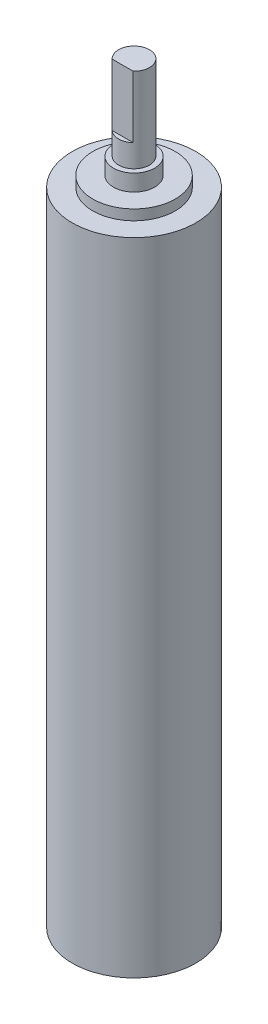
from build123d import *

# Parameters (mm, degrees)
SKETCH1_R             = 3
MOTORANDGEARBOX_DEPTH = 26.9
ENCODER_START         = 4.2
SKETCH2_R             = 3
ENCODER_DEPTH         = 4.2
SKETCH3_R             = 2
BOSS_EXTRUDE3_DEPTH   = 0.5
SKETCH4_R             = 1
BOSS_EXTRUDE4_DEPTH   = 0.8
SKETCH5_R             = 0.75
BOSS_EXTRUDE5_DEPTH   = 4.1
SKETCH6_OUTSIDE_W     = 15.494
SKETCH6_OUTSIDE_H     = 15.494
CUT_EXTRUDE1_DEPTH    = 3


with BuildPart() as part:
    # Sketch1 → motorAndGearbox (new body)
    with BuildSketch(Plane(origin=(0, 0, 0), x_dir=(1, 0, 0), z_dir=(0, 1, 0))):
        with Locations(Location((0, 0, 0), (0, 0, 90))):
            Circle(SKETCH1_R)
    extrude(amount=MOTORANDGEARBOX_DEPTH)

    # Sketch2 → encoder (add)
    with BuildSketch(Plane.XZ.offset(ENCODER_START)):
        with Locations(Location((0, 0, 0), (0, 0, 270))):
            Circle(SKETCH2_R)
    extrude(amount=-ENCODER_DEPTH)

    # Sketch3 → Boss-Extrude3 (add)
    with BuildSketch(Plane(origin=(0, 26.9, 0), x_dir=(1, 0, 0), z_dir=(0, 1, 0))):
        with Locations(Location((0, 0, 0), (0, 0, 270))):
            Circle(SKETCH3_R)
    extrude(amount=BOSS_EXTRUDE3_DEPTH)

    # Sketch4 → Boss-Extrude4 (add)
    with BuildSketch(Plane(origin=(0, 27.4, 0), x_dir=(1, 0, 0), z_dir=(0, 1, 0))):
        with Locations(Location((0, 0, 0), (0, 0, 270))):
            Circle(SKETCH4_R)
    extrude(amount=BOSS_EXTRUDE4_DEPTH)

    # Sketch5 → Boss-Extrude5 (add)
    with BuildSketch(Plane(origin=(0, 28.2, 0), x_dir=(1, 0, 0), z_dir=(0, 1, 0))):
        with Locations(Location((0, 0, 0), (0, 0, 270))):
            Circle(SKETCH5_R)
    extrude(amount=BOSS_EXTRUDE5_DEPTH)

    # Sketch6 outside → Cut-Extrude1 (cut)
    with BuildSketch(Plane(origin=(0, 32.3, 0), x_dir=(1, 0, 0), z_dir=(0, 1, 0))):
        Rectangle(SKETCH6_OUTSIDE_W, SKETCH6_OUTSIDE_H)
        with BuildLine():
            Line((-0.509901951, -0.55), (0.509901951, -0.55))
            ThreePointArc((0.509901951, -0.55), (0, 0.75), (-0.509901951, -0.55))
        make_face(mode=Mode.SUBTRACT)
    extrude(amount=-CUT_EXTRUDE1_DEPTH, mode=Mode.SUBTRACT)


solid = part.part
